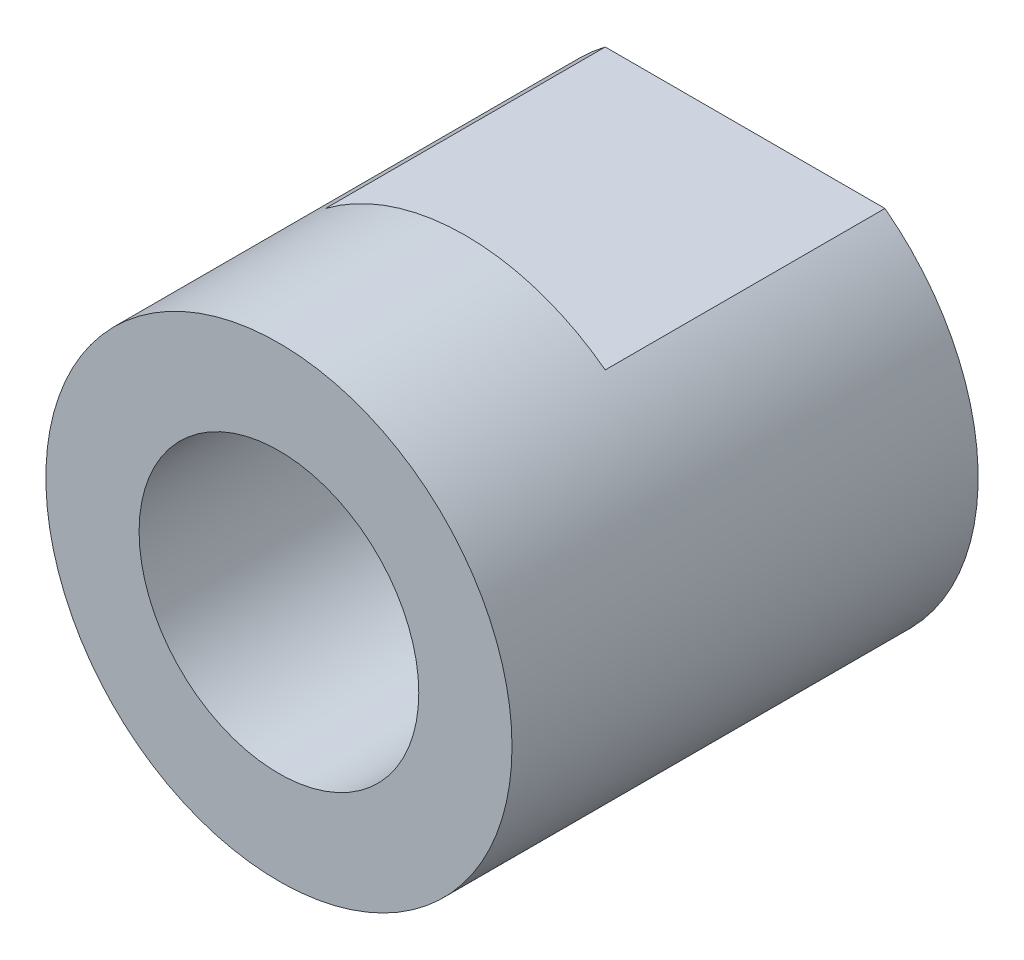
from build123d import *

# Parameters (mm, degrees)
ESQUISSE1_R                  = 5
BOSS_EXTRU_1_DEPTH           = 10
ESQUISSE2_R                  = 3
ENL_V_MAT_EXTRU_1_DEPTH      = 10
ENL_V_MAT_EXTRU_2_DEPTH      = 10
ENL_V_MAT_EXTRU_2_DEPTH_BACK = 10
ESQUISSE3_W                  = 6
ESQUISSE3_H                  = 1


with BuildPart() as part:
    # Esquisse1 → Boss.-Extru.1 (new body)
    with BuildSketch(Plane.XY):
        Circle(ESQUISSE1_R)
    extrude(amount=BOSS_EXTRU_1_DEPTH)

    # Esquisse2 → Enlèv. mat.-Extru.1 (cut)
    with BuildSketch(Plane.XY.offset(10)):
        Circle(ESQUISSE2_R)
    extrude(amount=-ENL_V_MAT_EXTRU_1_DEPTH, mode=Mode.SUBTRACT)

    # Esquisse3 → Enlèv. mat.-Extru.2 (cut, two sides: drawn at the far end of the back side and taken through both)
    with BuildSketch(Plane(origin=(0, 0, 0), x_dir=(0, 0, -1), z_dir=(1, 0, 0)).offset(-ENL_V_MAT_EXTRU_2_DEPTH_BACK)):
        with Locations((-3, 4.5)):
            Rectangle(ESQUISSE3_W, ESQUISSE3_H)
        with Locations((-3, -4.5)):
            Rectangle(ESQUISSE3_W, ESQUISSE3_H)
    extrude(amount=ENL_V_MAT_EXTRU_2_DEPTH + ENL_V_MAT_EXTRU_2_DEPTH_BACK, mode=Mode.SUBTRACT)


solid = part.part
